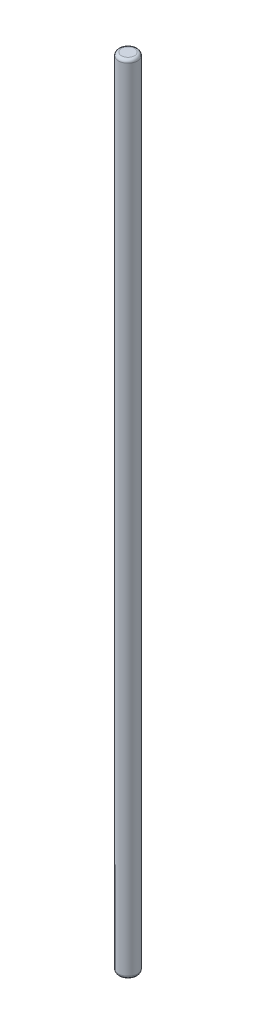
from build123d import *

# Parameters (mm, degrees)
SKETCH1_R           = 0.95
BOSS_EXTRUDE1_DEPTH = 80
FILLET1_R           = 0.3


with BuildPart() as part:
    # Sketch1 → Boss-Extrude1 (new body)
    with BuildSketch(Plane(origin=(0, 0, 0), x_dir=(1, 0, 0), z_dir=(0, 1, 0))):
        with Locations(Location((0, 0, 0), (0, 0, 270))):
            Circle(SKETCH1_R)
    extrude(amount=BOSS_EXTRUDE1_DEPTH)

    # Fillet1
    fillet1_edges = [part.edges().sort_by_distance(p)[0] for p in [
        (0, 0, -0.95),
        (0, 80, -0.95),
    ]]
    fillet(fillet1_edges, radius=FILLET1_R)


solid = part.part
